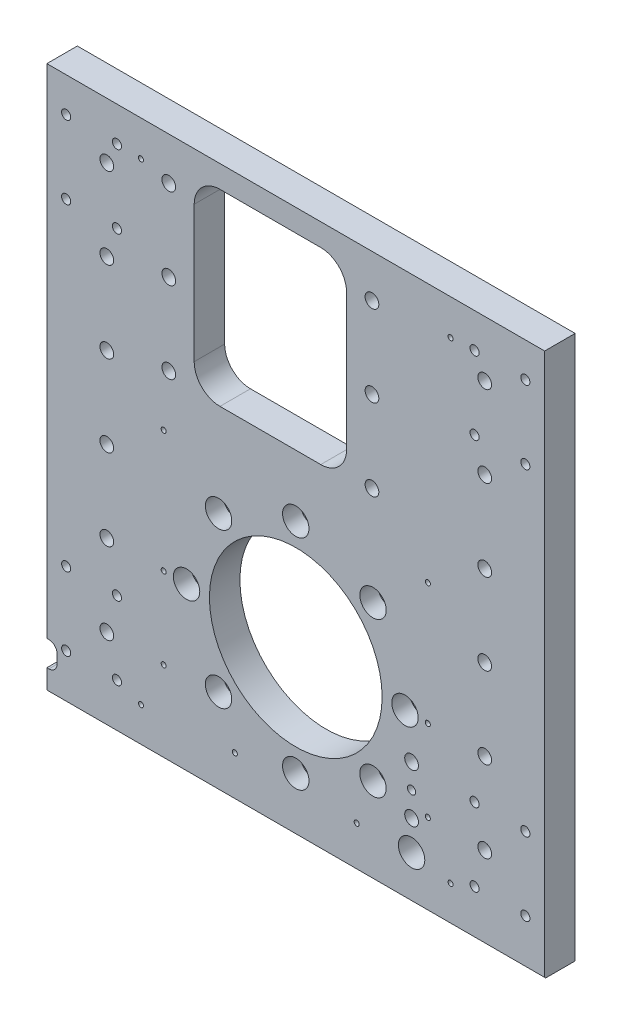
from build123d import *

# Parameters (mm, degrees)
SKETCH1_W                                            = 490
SKETCH1_H                                            = 535
BOSS_EXTRUDE1_DEPTH                                  = 19.05
SKETCH2_W                                            = 490
SKETCH2_H                                            = 4.05
CUT_EXTRUDE1_DEPTH                                   = 589.738399036
SKETCH3_R                                            = 85
CUT_EXTRUDE2_DEPTH                                   = 449.943203535
CBORE_FOR_M16_HEX_SOCKET_HEAD_CAP_SCREW1_D           = 17.5
CBORE_FOR_M16_HEX_SOCKET_HEAD_CAP_SCREW1_CBORE_D     = 26
CBORE_FOR_M16_HEX_SOCKET_HEAD_CAP_SCREW1_CBORE_DEPTH = 17.5
CBORE_FOR_M8_HEX_SOCKET_HEAD_CAP_SCREW1_D            = 9
CBORE_FOR_M8_HEX_SOCKET_HEAD_CAP_SCREW1_CBORE_D      = 15
CBORE_FOR_M8_HEX_SOCKET_HEAD_CAP_SCREW1_CBORE_DEPTH  = 9
CBORE_FOR_M12_HEX_SOCKET_HEAD_CAP_SCREW1_D           = 13.5
CBORE_FOR_M12_HEX_SOCKET_HEAD_CAP_SCREW1_CBORE_D     = 20
CBORE_FOR_M12_HEX_SOCKET_HEAD_CAP_SCREW1_CBORE_DEPTH = 13
CBORE_FOR_M12_HEX_SOCKET_HEAD_CAP_SCREW3_D           = 13.5
CBORE_FOR_M12_HEX_SOCKET_HEAD_CAP_SCREW3_CBORE_D     = 20
CBORE_FOR_M12_HEX_SOCKET_HEAD_CAP_SCREW3_CBORE_DEPTH = 13
F_8_0_8_DIAMETER_HOLE1_D                             = 8
M6_TAPPED_HOLE1_D                                    = 5
M6_TAPPED_HOLE1_DEPTH                                = 20.01
M6_TAPPED_HOLE1_TIP                                  = 1.502151548
F_13_5_13_5_DIAMETER_HOLE3_D                         = 13.5
F_13_5_13_5_DIAMETER_HOLE3_DEPTH                     = 15
F_13_5_13_5_DIAMETER_HOLE3_TIP                       = 4.055809178
CUT_EXTRUDE6_DEPTH                                   = 449.943203535
M6_TAPPED_HOLE2_D                                    = 5
M6_TAPPED_HOLE2_DEPTH                                = 27.99
M6_TAPPED_HOLE2_TIP                                  = 1.502151548
CBORE_FOR_M12_HEX_SOCKET_HEAD_CAP_SCREW2_D           = 13.5
CBORE_FOR_M12_HEX_SOCKET_HEAD_CAP_SCREW2_CBORE_D     = 20
CBORE_FOR_M12_HEX_SOCKET_HEAD_CAP_SCREW2_CBORE_DEPTH = 13
LPATTERN1_COUNT                                      = 6
LPATTERN1_PITCH                                      = 80
F_26_0_26_DIAMETER_HOLE1_D                           = 26
CHAMFER1_SIZE                                        = 1
M6_TAPPED_HOLE3_D                                    = 5
M6_TAPPED_HOLE3_DEPTH                                = 27.99
M6_TAPPED_HOLE3_TIP                                  = 1.502151548
CUT_EXTRUDE7_DEPTH                                   = 449.943203535


with BuildPart() as part:
    # Sketch1 → Boss-Extrude1 (new, symmetric)
    with BuildSketch(Plane.XY):
        with Locations((0, 107.5)):
            Rectangle(SKETCH1_W, SKETCH1_H)
    extrude(amount=BOSS_EXTRUDE1_DEPTH, both=True)

    # Sketch2 → Cut-Extrude1 (cut, through all)
    with BuildSketch(Plane(origin=(0, 375, 0), x_dir=(1, 0, 0), z_dir=(0, 1, 0))):
        with Locations((0, 17.025)):
            Rectangle(SKETCH2_W, SKETCH2_H)
        with Locations((0, -17.025)):
            Rectangle(SKETCH2_W, SKETCH2_H)
    extrude(amount=-CUT_EXTRUDE1_DEPTH, mode=Mode.SUBTRACT)

    # Sketch3 → Cut-Extrude2 (cut, through all)
    with BuildSketch(Plane.XY.offset(15)):
        Circle(SKETCH3_R)
    extrude(amount=-CUT_EXTRUDE2_DEPTH, mode=Mode.SUBTRACT)

    # CBORE for M16 Hex Socket Head Cap Screw1 (through all)
    with Locations(Plane.XY.offset(15)):
        with Locations((0, 107.5), (76.013978978, 76.013978978), (-76.013978978, 76.013978978), (-107.5, 0), (-76.013978978, -76.013978978), (0, -107.5), (76.013978978, -76.013978978), (107.5, 0)):
            CounterBoreHole(CBORE_FOR_M16_HEX_SOCKET_HEAD_CAP_SCREW1_D / 2, CBORE_FOR_M16_HEX_SOCKET_HEAD_CAP_SCREW1_CBORE_D / 2, CBORE_FOR_M16_HEX_SOCKET_HEAD_CAP_SCREW1_CBORE_DEPTH)

    # CBORE for M8 Hex Socket Head Cap Screw1 (through all)
    with Locations(Plane(origin=(0, 0, -15), x_dir=(-1, 0, 0), z_dir=(0, 0, -1))):
        with Locations((226, -116), (176, -116), (176, -44), (226, -44), (-226, -44), (-176, -44), (-176, -116), (-226, -116), (-226, 341), (-176, 269), (-226, 269), (-176, 341), (176, 341), (226, 269), (176, 269), (226, 341)):
            CounterBoreHole(CBORE_FOR_M8_HEX_SOCKET_HEAD_CAP_SCREW1_D / 2, CBORE_FOR_M8_HEX_SOCKET_HEAD_CAP_SCREW1_CBORE_D / 2, CBORE_FOR_M8_HEX_SOCKET_HEAD_CAP_SCREW1_CBORE_DEPTH)

    # CBORE for M12 Hex Socket Head Cap Screw1 (through all)
    with Locations(Plane(origin=(0, 0, -15), x_dir=(-1, 0, 0), z_dir=(0, 0, -1))):
        with Locations((-75, 173), (125, 173), (125, 253), (125, 333), (-75, 253), (-75, 333)):
            CounterBoreHole(CBORE_FOR_M12_HEX_SOCKET_HEAD_CAP_SCREW1_D / 2, CBORE_FOR_M12_HEX_SOCKET_HEAD_CAP_SCREW1_CBORE_D / 2, CBORE_FOR_M12_HEX_SOCKET_HEAD_CAP_SCREW1_CBORE_DEPTH)

    # CBORE for M12 Hex Socket Head Cap Screw3 (through all)
    with Locations(Plane(origin=(0, 0, -15), x_dir=(-1, 0, 0), z_dir=(0, 0, -1))):
        with Locations((-114, -40.73999995), (-114, -88.73999995)):
            CounterBoreHole(CBORE_FOR_M12_HEX_SOCKET_HEAD_CAP_SCREW3_D / 2, CBORE_FOR_M12_HEX_SOCKET_HEAD_CAP_SCREW3_CBORE_D / 2, CBORE_FOR_M12_HEX_SOCKET_HEAD_CAP_SCREW3_CBORE_DEPTH)

    # Ø8.0 (8) Diameter Hole1 (through all)
    with Locations(Plane(origin=(0, 0, -15), x_dir=(-1, 0, 0), z_dir=(0, 0, -1))):
        with Locations((-114, -64.73999995)):
            Hole(F_8_0_8_DIAMETER_HOLE1_D / 2)

    # M6 Tapped Hole1
    with Locations(Plane(origin=(0, 0, 15), x_dir=(-1, 0, 0), z_dir=(0, 0, 1))):
        with Locations((-130, 80), (-60, 120), (60, 120), (130, 80), (130, 0), (130, -120), (-130, -120), (-130, 0)):
            Hole(M6_TAPPED_HOLE1_D / 2, depth=M6_TAPPED_HOLE1_DEPTH)
            with Locations((0, 0, -(M6_TAPPED_HOLE1_DEPTH + M6_TAPPED_HOLE1_TIP / 2))):  # 118° drill point
                Cone(0, M6_TAPPED_HOLE1_D / 2, M6_TAPPED_HOLE1_TIP, mode=Mode.SUBTRACT)

    # Ø13.5 (13.5) Diameter Hole3
    with Locations(Plane(origin=(0, 0, -15), x_dir=(-1, 0, 0), z_dir=(0, 0, -1))):
        with Locations((-114, -64.73999995), (-130, -80)):
            Hole(F_13_5_13_5_DIAMETER_HOLE3_D / 2, depth=F_13_5_13_5_DIAMETER_HOLE3_DEPTH)
            with Locations((0, 0, -(F_13_5_13_5_DIAMETER_HOLE3_DEPTH + F_13_5_13_5_DIAMETER_HOLE3_TIP / 2))):  # 118° drill point
                Cone(0, F_13_5_13_5_DIAMETER_HOLE3_D / 2, F_13_5_13_5_DIAMETER_HOLE3_TIP, mode=Mode.SUBTRACT)

    # Sketch24 → Cut-Extrude6 (cut, through all)
    with BuildSketch(Plane(origin=(0, 0, -15), x_dir=(-1, 0, 0), z_dir=(0, 0, -1))):
        with BuildLine():
            Line((-24.6, 353), (74.6, 353))
            ThreePointArc((74.6, 353), (92.560512242, 345.560512242), (100, 327.6))
            Line((100, 327.6), (100, 193.4))
            ThreePointArc((100, 193.4), (92.560512242, 175.439487758), (74.6, 168))
            Line((74.6, 168), (-24.6, 168))
            ThreePointArc((-24.6, 168), (-42.560512242, 175.439487758), (-50, 193.4))
            Line((-50, 193.4), (-50, 327.6))
            ThreePointArc((-50, 327.6), (-42.560512242, 345.560512242), (-24.6, 353))
        make_face()
    extrude(amount=-CUT_EXTRUDE6_DEPTH, mode=Mode.SUBTRACT)

    # M6 Tapped Hole2
    with Locations(Plane(origin=(0, 0, -15), x_dir=(-1, 0, 0), z_dir=(0, 0, -1))):
        with Locations((226, 327.5), (-226, 327.5), (226, 147.5), (226, -132.5), (-226, -132.5), (-226, 147.5)):
            Hole(M6_TAPPED_HOLE2_D / 2, depth=M6_TAPPED_HOLE2_DEPTH)
            with Locations((0, 0, -(M6_TAPPED_HOLE2_DEPTH + M6_TAPPED_HOLE2_TIP / 2))):  # 118° drill point
                Cone(0, M6_TAPPED_HOLE2_D / 2, M6_TAPPED_HOLE2_TIP, mode=Mode.SUBTRACT)

    # CBORE for M12 Hex Socket Head Cap Screw2 (through all)
    with Locations(Plane(origin=(0, 0, -15), x_dir=(-1, 0, 0), z_dir=(0, 0, -1))):
        with Locations((-186, -80), (186, -80)):
            cbore_for_m12_hex_socket_head_cap_screw2 = CounterBoreHole(CBORE_FOR_M12_HEX_SOCKET_HEAD_CAP_SCREW2_D / 2, CBORE_FOR_M12_HEX_SOCKET_HEAD_CAP_SCREW2_CBORE_D / 2, CBORE_FOR_M12_HEX_SOCKET_HEAD_CAP_SCREW2_CBORE_DEPTH)

    # LPattern1: CBORE for M12 Hex Socket Head Cap Screw2 ×6
    with Locations(*[(0, i * LPATTERN1_PITCH, 0) for i in range(1, LPATTERN1_COUNT)]):
        add(cbore_for_m12_hex_socket_head_cap_screw2, mode=Mode.SUBTRACT)

    # Ø26.0 (26) Diameter Hole1 (through all)
    with Locations(Plane(origin=(0, 0, -15), x_dir=(-1, 0, 0), z_dir=(0, 0, -1))):
        with Locations((-114, -118)):
            Hole(F_26_0_26_DIAMETER_HOLE1_D / 2)

    # Chamfer1
    chamfer1_edges = [part.edges().sort_by_distance(p)[0] for p in [
        (0, -160, 15),
    ]]
    chamfer(chamfer1_edges, length=CHAMFER1_SIZE)

    # M6 Tapped Hole3
    with Locations(Plane.XY.offset(15)):
        with Locations((-152.4, 340.075), (152.4, -125.075), (-152.4, -125.075), (152.4, 340.075)):
            Hole(M6_TAPPED_HOLE3_D / 2, depth=M6_TAPPED_HOLE3_DEPTH)
            with Locations((0, 0, -(M6_TAPPED_HOLE3_DEPTH + M6_TAPPED_HOLE3_TIP / 2))):  # 118° drill point
                Cone(0, M6_TAPPED_HOLE3_D / 2, M6_TAPPED_HOLE3_TIP, mode=Mode.SUBTRACT)

    # Sketch35 → Cut-Extrude7 (cut, through all)
    with BuildSketch(Plane(origin=(0, 0, -15), x_dir=(-1, 0, 0), z_dir=(0, 0, -1))):
        with BuildLine():
            Line((245, -115), (243, -115))
            ThreePointArc((243, -115), (237.343145751, -117.343145751), (235, -123))
            Line((235, -123), (235, -132))
            ThreePointArc((235, -132), (237.343145751, -137.656854249), (243, -140))
            Line((243, -140), (245, -140))
            Line((245, -140), (245, -115))
        make_face()
    extrude(amount=-CUT_EXTRUDE7_DEPTH, mode=Mode.SUBTRACT)


solid = part.part
